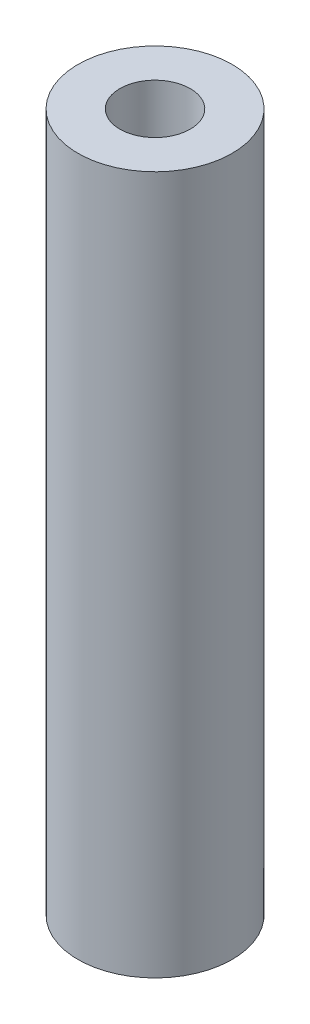
from build123d import *

# Parameters (mm, degrees)
SKETCH1_W = 3.81
SKETCH1_H = 63.5


with BuildPart() as part:
    # Sketch1 → Revolve1 (revolve)
    with BuildSketch(Plane.XY, mode=Mode.PRIVATE) as revolve1_sk:
        with Locations((5.1054, 31.75)):
            Rectangle(SKETCH1_W, SKETCH1_H)
    revolve(revolve1_sk.sketch.rotate(Axis((0, 0, 0), (0, 1, 0)), 90), axis=Axis((0, 0, 0), (0, 1, 0)))


solid = part.part
